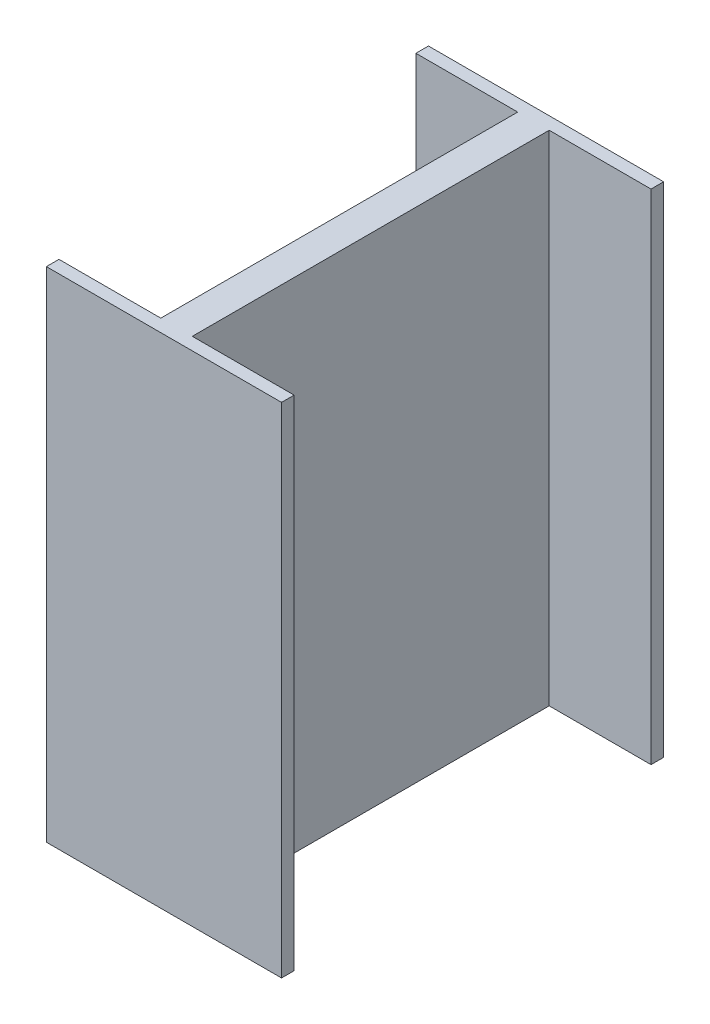
from build123d import *

# Parameters (mm, degrees)
BOSS_EXTRUDE2_DEPTH = 1187.25


with BuildPart() as part:
    # Sketch1 → Boss-Extrude2 (new body)
    with BuildSketch(Plane(origin=(0, 0, 0), x_dir=(1, 0, 0), z_dir=(0, 1, 0))):
        Polygon((-37.5, 455), (37.5, 455), (280.014880557, 455), (280.014880557, 425), (37.5, 425), (37.5, -425), (280.014880557, -425), (280.014880557, -455), (37.5, -455), (-37.5, -455), (-280.014880557, -455), (-280.014880557, -425), (-37.5, -425), (-37.5, 425), (-280.014880557, 425), (-280.014880557, 455), align=None)
    extrude(amount=BOSS_EXTRUDE2_DEPTH)


solid = part.part
